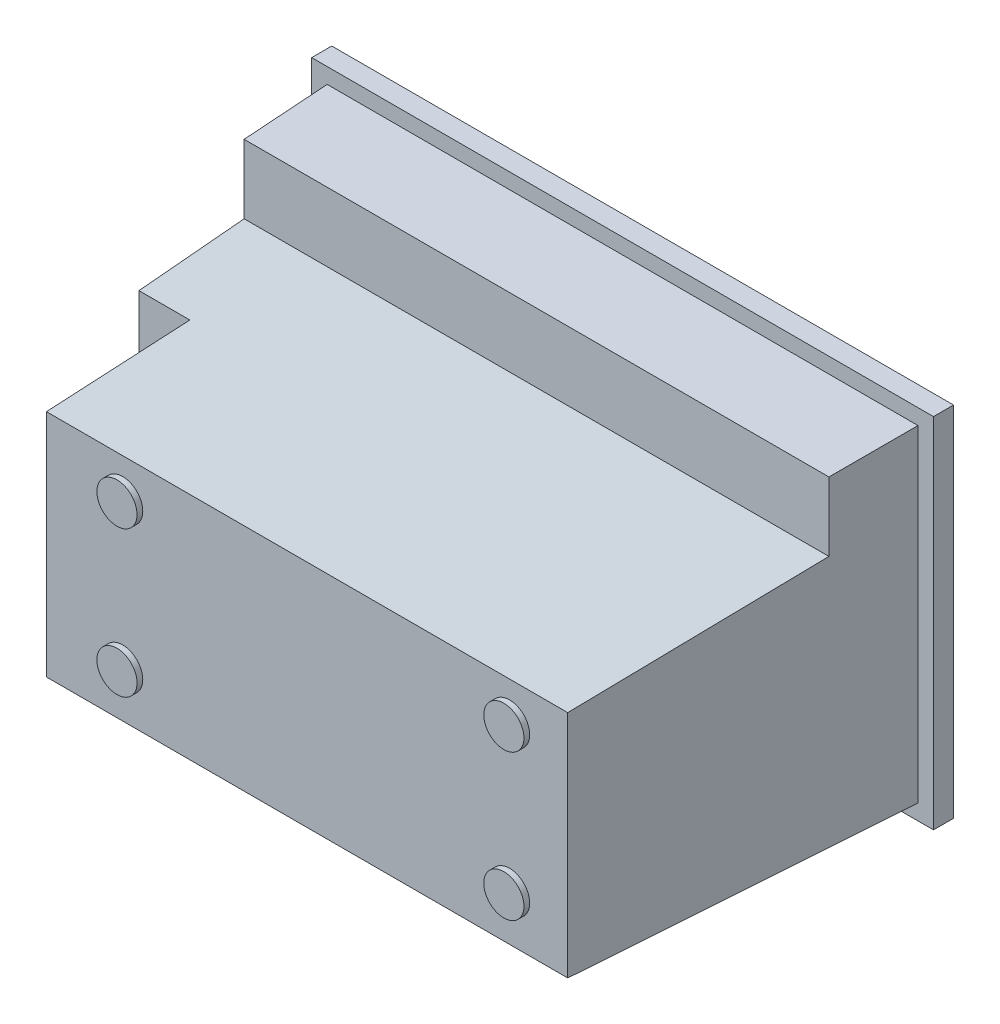
from build123d import *

# Parameters (mm, degrees)
SKETCH_1_W               = 103
SKETCH_1_H               = 57
EXTRUDE_1_DEPTH          = 59
EXTRUDE_1_TAPER          = 2
SKETCH_2_W               = 39.54031551
SKETCH_2_H               = 84.548972525
CUT_EXTRUDE_1_DEPTH      = 25
SKETCH_3_R               = 3.5
EXTRUDE_2_DEPTH          = 1
SKETCH_4_W               = 108.4
SKETCH_4_H               = 62.4
EXTRUDE_3_DEPTH          = 3.5
CUT_EXTRUDE_2_DEPTH      = 87.666487179
CUT_EXTRUDE_2_DEPTH_BACK = 87.666487179
SKETCH_6_W               = 89.310356146
SKETCH_6_H               = 15.122271459
CUT_EXTRUDE_3_DEPTH      = 0.5


with BuildPart() as part:
    # 草图1 → 拉伸1 (new body)
    with BuildSketch(Plane.XY):
        Rectangle(SKETCH_1_W, SKETCH_1_H)
    extrude(amount=EXTRUDE_1_DEPTH, taper=EXTRUDE_1_TAPER)

    # 草图2 → 切除-拉伸1 (cut)
    with BuildSketch(Plane.XY.offset(59)):
        with Locations((-61.209832355, 4.206416544)):
            Rectangle(SKETCH_2_W, SKETCH_2_H)
    extrude(amount=-CUT_EXTRUDE_1_DEPTH, mode=Mode.SUBTRACT)

    # 草图3 → 拉伸2 (add)
    with BuildSketch(Plane.XY.offset(59)):
        with Locations((-28.146233383, 6.977331271)):
            Circle(SKETCH_3_R)
        with Locations((39.303298868, 6.977331271)):
            Circle(SKETCH_3_R)
        with Locations((-28.146233383, -18.443352833)):
            Circle(SKETCH_3_R)
        with Locations((39.303298868, -18.443352833)):
            Circle(SKETCH_3_R)
    extrude(amount=EXTRUDE_2_DEPTH)

    # 草图4 → 拉伸3 (add)
    with BuildSketch(Plane(origin=(0, 0, 0), x_dir=(-1, 0, 0), z_dir=(0, 0, -1))):
        Rectangle(SKETCH_4_W, SKETCH_4_H)
    extrude(amount=EXTRUDE_3_DEPTH)

    # 草图5 → 切除-拉伸2 (cut, two sides: drawn at the far end of the back side and taken through both)
    with BuildSketch(Plane(origin=(0, 0, 0), x_dir=(0, 0, -1), z_dir=(1, 0, 0)).offset(-CUT_EXTRUDE_2_DEPTH_BACK)):
        Polygon((-59, 13.626611521), (-15, 15.976188458), (-15, 27.976188458), (-59, 29.657919194), align=None)
    extrude(amount=CUT_EXTRUDE_2_DEPTH + CUT_EXTRUDE_2_DEPTH_BACK, mode=Mode.SUBTRACT)

    # 草图6 → 切除-拉伸3 (cut)
    with BuildSketch(Plane(origin=(0, 0, -3.5), x_dir=(-1, 0, 0), z_dir=(0, 0, -1))):
        with Locations((-1.512227146, -17.435089447)):
            Rectangle(SKETCH_6_W, SKETCH_6_H)
    extrude(amount=-CUT_EXTRUDE_3_DEPTH, mode=Mode.SUBTRACT)


solid = part.part
